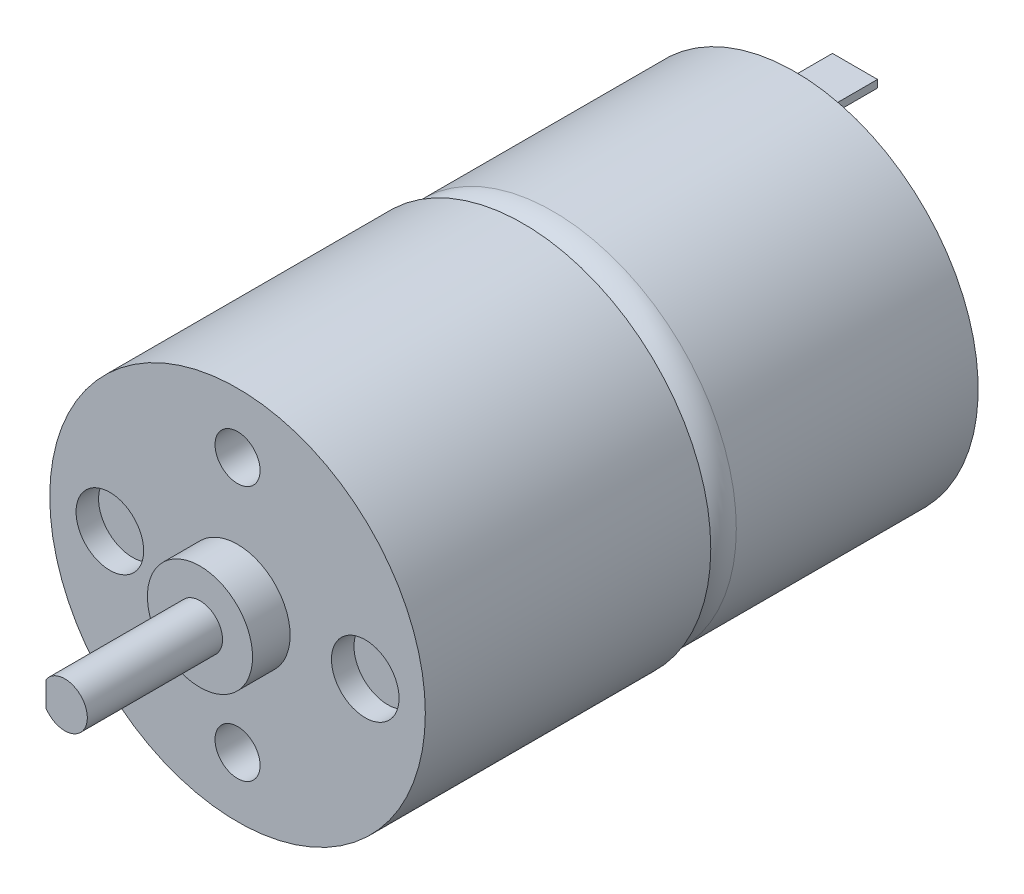
from build123d import *

# Parameters (mm, degrees)
SKETCH_1_R          = 12.2
EXTRUDE_1_DEPTH     = 18.1
FILLET_1_R          = 2
SKETCH_2_R          = 12.5
EXTRUDE_2_DEPTH     = 19
SKETCH_3_R          = 3.5
EXTRUDE_3_DEPTH     = 2.5
SKETCH_4_R          = 1.5
EXTRUDE_4_DEPTH     = 9
CUT_EXTRUDE_1_DEPTH = 8
SKETCH_6_R          = 2.25
CUT_EXTRUDE_2_DEPTH = 1.5
SKETCH_8_R          = 1.5
CUT_EXTRUDE_3_DEPTH = 6
SKETCH_9_R          = 3.25
EXTRUDE_5_DEPTH     = 2
SKETCH_10_W         = 3
SKETCH_10_H         = 0.5
EXTRUDE_6_DEPTH     = 4


with BuildPart() as part:
    # 草图1 → 凸台-拉伸1 (new body)
    with BuildSketch(Plane.XY):
        with Locations(Location((0, 0, 0), (0, 0, 180))):
            Circle(SKETCH_1_R)
    extrude(amount=EXTRUDE_1_DEPTH)

    # 圆角1
    fillet_1_edges = [part.edges().sort_by_distance(p)[0] for p in [
        (12.2, 0, 18.1),
    ]]
    fillet(fillet_1_edges, radius=FILLET_1_R)

    # 草图2 → 凸台-拉伸2 (add)
    with BuildSketch(Plane.XY.offset(18.1)):
        Circle(SKETCH_2_R)
    extrude(amount=EXTRUDE_2_DEPTH)

    # 草图3 → 凸台-拉伸3 (add)
    with BuildSketch(Plane.XY.offset(37.1)):
        Circle(SKETCH_3_R)
    extrude(amount=EXTRUDE_3_DEPTH)

    # 草图4 → 凸台-拉伸4 (add)
    with BuildSketch(Plane.XY.offset(39.6)):
        Circle(SKETCH_4_R)
    extrude(amount=EXTRUDE_4_DEPTH)

    # 草图5 → 切除-拉伸1 (cut)
    with BuildSketch(Plane.XY.offset(48.6)):
        Polygon((-1.25, -49.129490658), (-1.25, -0.829156198), (-1.25, 0.829156198), (-1.25, 49.129490658), (-97.85066892, 49.129490658), (-97.85066892, -49.129490658), align=None)
    extrude(amount=-CUT_EXTRUDE_1_DEPTH, mode=Mode.SUBTRACT)

    # 草图6 → 切除-拉伸2 (cut)
    with BuildSketch(Plane.XY.offset(37.1)):
        with Locations((8.5, 0)):
            Circle(SKETCH_6_R)
        with Locations((-8.5, 0)):
            Circle(SKETCH_6_R)
    extrude(amount=-CUT_EXTRUDE_2_DEPTH, mode=Mode.SUBTRACT)

    # 草图8 → 切除-拉伸3 (cut)
    with BuildSketch(Plane.XY.offset(37.1)):
        with Locations((0, 8.5)):
            Circle(SKETCH_8_R)
        with Locations((0, -8.5)):
            Circle(SKETCH_8_R)
    extrude(amount=-CUT_EXTRUDE_3_DEPTH, mode=Mode.SUBTRACT)

    # 草图9 → 凸台-拉伸5 (add)
    with BuildSketch(Plane(origin=(0, 0, 0), x_dir=(-1, 0, 0), z_dir=(0, 0, -1))):
        with Locations(Location((0, 0, 0), (0, 0, 180))):
            Circle(SKETCH_9_R)
    extrude(amount=EXTRUDE_5_DEPTH)

    # 草图10 → 凸台-拉伸6 (add)
    with BuildSketch(Plane(origin=(0, 0, 0), x_dir=(-1, 0, 0), z_dir=(0, 0, -1))):
        with Locations((0, 10.25)):
            Rectangle(SKETCH_10_W, SKETCH_10_H)
        with Locations((0, -10.25)):
            Rectangle(SKETCH_10_W, SKETCH_10_H)
    extrude(amount=EXTRUDE_6_DEPTH)


solid = part.part
